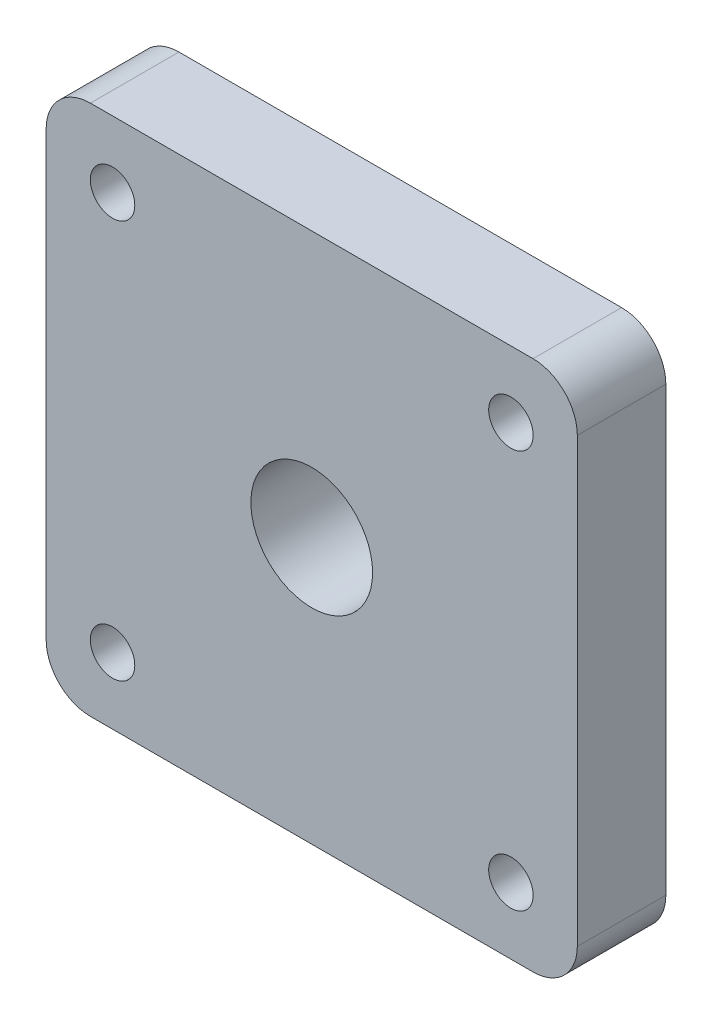
from build123d import *

# Parameters (mm, degrees)
SKETCH1_R           = 8.73125
SKETCH1_R_2         = 3.1877
BOSS_EXTRUDE1_DEPTH = 12.7
SCALE1_SCALE        = 0.66


with BuildPart() as part:
    # Sketch1 → Boss-Extrude1 (new body)
    with BuildSketch(Plane.XY):
        with BuildLine():
            Line((-31.75, 38.1), (31.75, 38.1))
            ThreePointArc((31.75, 38.1), (36.240128061, 36.240128061), (38.1, 31.75))
            Line((38.1, 31.75), (38.1, -31.75))
            ThreePointArc((38.1, -31.75), (36.240128061, -36.240128061), (31.75, -38.1))
            Line((31.75, -38.1), (-31.75, -38.1))
            ThreePointArc((-31.75, -38.1), (-36.240128061, -36.240128061), (-38.1, -31.75))
            Line((-38.1, -31.75), (-38.1, 31.75))
            ThreePointArc((-38.1, 31.75), (-36.240128061, 36.240128061), (-31.75, 38.1))
        make_face()
        Circle(SKETCH1_R, mode=Mode.SUBTRACT)
        with Locations((-28.575, 28.575)):
            Circle(SKETCH1_R_2, mode=Mode.SUBTRACT)
        with Locations((28.575, 28.575)):
            Circle(SKETCH1_R_2, mode=Mode.SUBTRACT)
        with Locations((28.575, -28.575)):
            Circle(SKETCH1_R_2, mode=Mode.SUBTRACT)
        with Locations((-28.575, -28.575)):
            Circle(SKETCH1_R_2, mode=Mode.SUBTRACT)
    extrude(amount=BOSS_EXTRUDE1_DEPTH)


with BuildPart() as part_1:
    # Scale1: scaled about (0, 0, 6.35)
    add(part.part.scale(SCALE1_SCALE).moved(Location((0, 0, 2.159))))


solid = part_1.part
